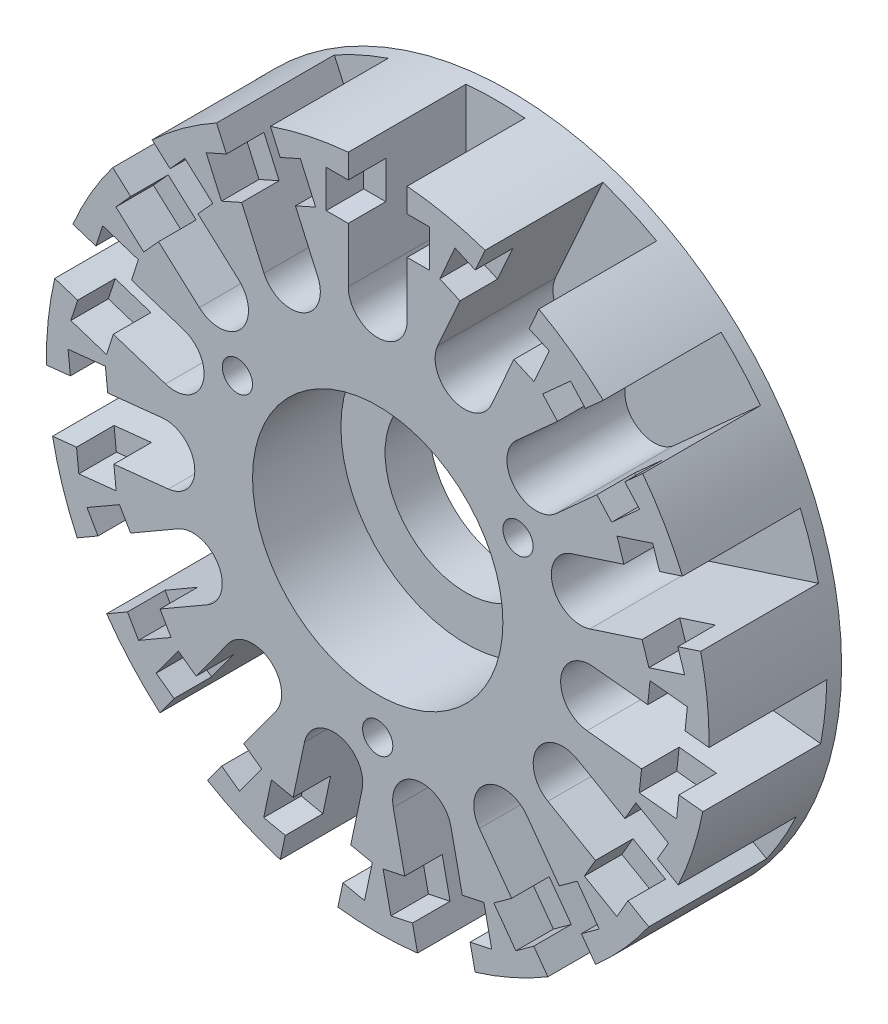
from build123d import *

# Parameters (mm, degrees)
SKETCH1_W                                = 22.5
SKETCH1_H                                = 9
CUT_EXTRUDE1_START                       = -8
CUT_EXTRUDE1_DEPTH                       = 8
SKETCH3_W                                = 2.55
SKETCH3_H                                = 2.55
CUT_EXTRUDE2_DEPTH                       = 1.5
SKETCH4_W                                = 2.55
SKETCH4_H                                = 2.55
CUT_EXTRUDE3_DEPTH                       = 1.5
M2_5X0_45_TAPPED_HOLE1_D                 = 2.05
M2_5X0_45_TAPPED_HOLE1_DEPTH             = 6
M2_5X0_45_TAPPED_HOLE1_TIP               = 0.615882135
CBORE_FOR_M12_HEX_HEAD_BOLT1_D           = 11
CBORE_FOR_M12_HEX_HEAD_BOLT1_CBORE_D     = 17
CBORE_FOR_M12_HEX_HEAD_BOLT1_CBORE_DEPTH = 6
M3X0_5_TAPPED_HOLE1_D                    = 2.5
M3X0_5_TAPPED_HOLE1_DEPTH                = 5
M3X0_5_TAPPED_HOLE1_TIP                  = 0.751075774
CIRPATTERN1_COUNT                        = 15


with BuildPart() as part:
    # Sketch1 → Revolve1 (revolve)
    with BuildSketch(Plane(origin=(0, 0, 0), x_dir=(1, 0, 0), z_dir=(0, 1, 0))):
        with Locations((11.25, -4.5)):
            Rectangle(SKETCH1_W, SKETCH1_H)
    revolve(axis=Axis((0, 0, 0), (0, 0, 1)))

    # Sketch2 → Cut-Extrude1 (cut)
    with BuildSketch(Plane.XY.offset(9).offset(CUT_EXTRUDE1_START)):
        with BuildLine():
            Line((-1.999999998, 22.410934831), (-1.999999998, 14.5))
            ThreePointArc((-1.999999998, 14.5), (3e-09, 12.499999999), (2.000000005, 14.5))
            Line((2.000000005, 14.5), (2.000000005, 22.410934831))
            ThreePointArc((2.000000005, 22.410934831), (3e-09, 22.5), (-1.999999998, 22.410934831))
        make_face()
    cut_extrude1 = extrude(amount=CUT_EXTRUDE1_DEPTH, mode=Mode.SUBTRACT)

    # Sketch3 → Cut-Extrude2 (cut)
    with BuildSketch(Plane.ZY.offset(-2.000000005)):
        with Locations((7.725, 19.5)):
            Rectangle(SKETCH3_W, SKETCH3_H)
    cut_extrude2 = extrude(amount=-CUT_EXTRUDE2_DEPTH, mode=Mode.SUBTRACT)

    # Sketch4 → Cut-Extrude3 (cut)
    with BuildSketch(Plane(origin=(-1.999999998, 0, 0), x_dir=(0, 0, -1), z_dir=(1, 0, 0))):
        with Locations((-7.725, 19.5)):
            Rectangle(SKETCH4_W, SKETCH4_H)
    cut_extrude3 = extrude(amount=-CUT_EXTRUDE3_DEPTH, mode=Mode.SUBTRACT)

    # M2.5x0.45 Tapped Hole1
    with Locations(Plane.XY.offset(9)):
        with Locations((9.526279442, 5.5), (0, -11), (-9.526279442, 5.5)):
            Hole(M2_5X0_45_TAPPED_HOLE1_D / 2, depth=M2_5X0_45_TAPPED_HOLE1_DEPTH)
            with Locations((0, 0, -(M2_5X0_45_TAPPED_HOLE1_DEPTH + M2_5X0_45_TAPPED_HOLE1_TIP / 2))):  # 118° drill point
                Cone(0, M2_5X0_45_TAPPED_HOLE1_D / 2, M2_5X0_45_TAPPED_HOLE1_TIP, mode=Mode.SUBTRACT)

    # CBORE for M12 Hex Head Bolt1 (through all)
    with Locations(Plane.XY.offset(9)):
        with Locations((0, 0)):
            CounterBoreHole(CBORE_FOR_M12_HEX_HEAD_BOLT1_D / 2, CBORE_FOR_M12_HEX_HEAD_BOLT1_CBORE_D / 2, CBORE_FOR_M12_HEX_HEAD_BOLT1_CBORE_DEPTH)

    # M3x0.5 Tapped Hole1
    with Locations(Plane(origin=(0, 0, 0), x_dir=(-1, 0, 0), z_dir=(0, 0, -1))):
        with Locations((16.887495374, 9.75), (-16.887495374, 9.75), (0, -19.5)):
            Hole(M3X0_5_TAPPED_HOLE1_D / 2, depth=M3X0_5_TAPPED_HOLE1_DEPTH)
            with Locations((0, 0, -(M3X0_5_TAPPED_HOLE1_DEPTH + M3X0_5_TAPPED_HOLE1_TIP / 2))):  # 118° drill point
                Cone(0, M3X0_5_TAPPED_HOLE1_D / 2, M3X0_5_TAPPED_HOLE1_TIP, mode=Mode.SUBTRACT)

    # CirPattern1: Cut-Extrude1, Cut-Extrude2, Cut-Extrude3 ×15 about axis
    cirpattern1_axis = Axis((0, 0, 0), (0, 0, 1))
    add([cut_extrude1.rotate(cirpattern1_axis, i * 360 / CIRPATTERN1_COUNT) for i in range(1, CIRPATTERN1_COUNT)], mode=Mode.SUBTRACT)
    add([cut_extrude2.rotate(cirpattern1_axis, i * 360 / CIRPATTERN1_COUNT) for i in range(1, CIRPATTERN1_COUNT)], mode=Mode.SUBTRACT)
    add([cut_extrude3.rotate(cirpattern1_axis, i * 360 / CIRPATTERN1_COUNT) for i in range(1, CIRPATTERN1_COUNT)], mode=Mode.SUBTRACT)


solid = part.part
